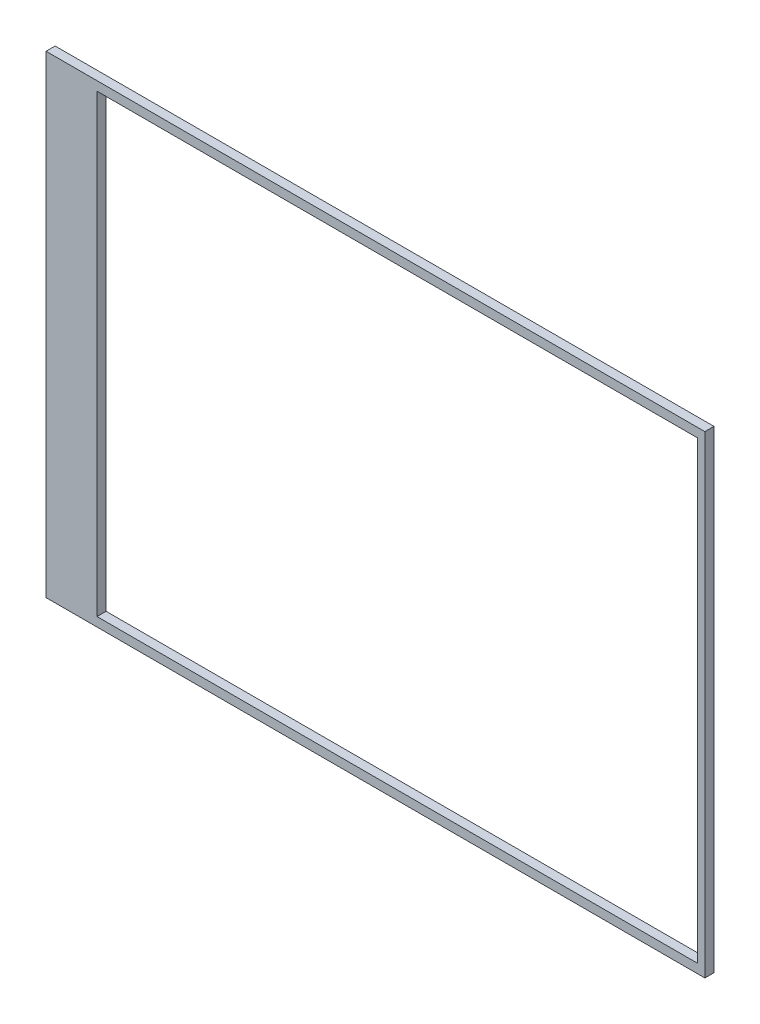
from build123d import *

# Parameters (mm, degrees)
SKIZZE1_W                       = 72.4
SKIZZE1_H                       = 52
SKIZZE1_W_2                     = 66
SKIZZE1_H_2                     = 50
AUFSATZ_LINEAR_AUSTRAGEN1_DEPTH = 1


with BuildPart() as part:
    # Skizze1 → Aufsatz-Linear austragen1 (new body)
    with BuildSketch(Plane.XY):
        with Locations((-3.516633548, -14.776595745)):
            Rectangle(SKIZZE1_W, SKIZZE1_H)
        with Locations((-1.116633548, -14.776595745)):
            Rectangle(SKIZZE1_W_2, SKIZZE1_H_2, mode=Mode.SUBTRACT)
    extrude(amount=AUFSATZ_LINEAR_AUSTRAGEN1_DEPTH)


solid = part.part
